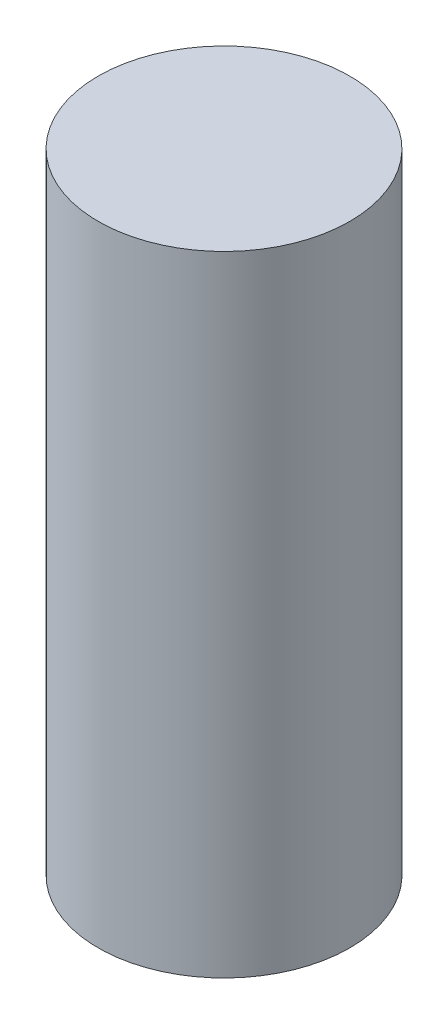
from build123d import *

# Parameters (mm, degrees)
SKETCH_1_R      = 2
EXTRUDE_1_DEPTH = 10


with BuildPart() as part:
    # 草图1 → 凸台-拉伸1 (new body)
    with BuildSketch(Plane(origin=(0, 22.5, 0), x_dir=(1, 0, 0), z_dir=(0, 1, 0))):
        with Locations(Location((39.5, 0, 0), (0, 0, 180))):
            Circle(SKETCH_1_R)
    extrude(amount=EXTRUDE_1_DEPTH)


solid = part.part
